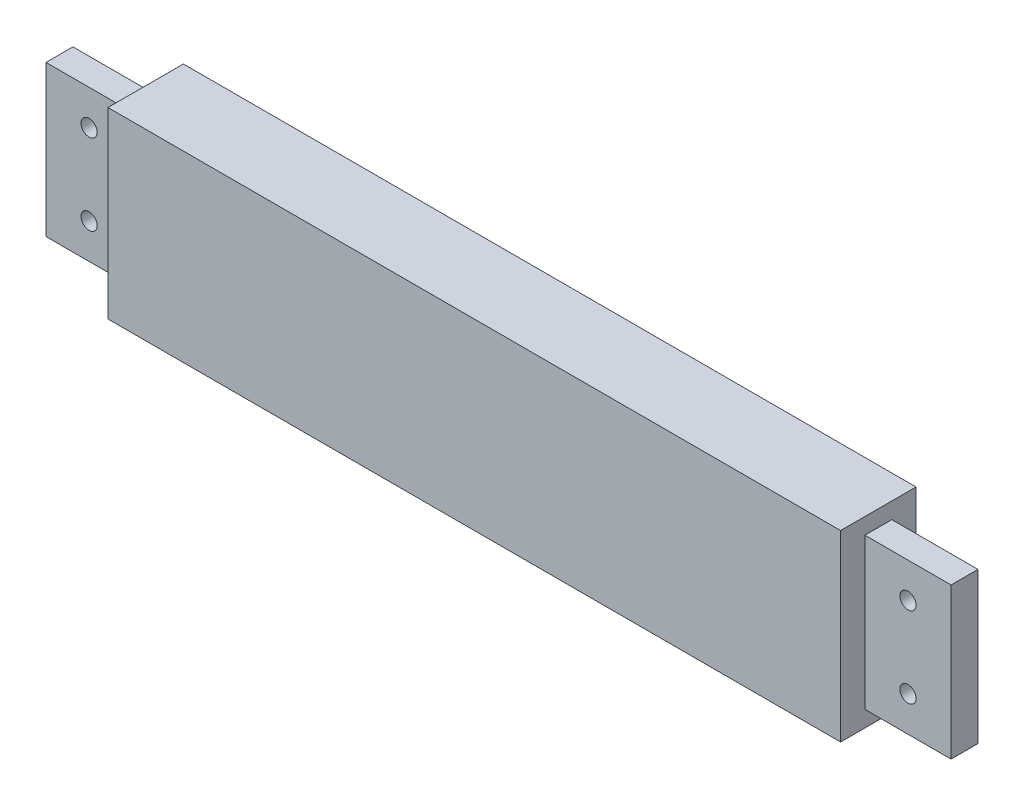
from build123d import *

# Parameters (mm, degrees)
SKETCH1_W           = 431.8
SKETCH1_H           = 107.95
BOSS_EXTRUDE1_DEPTH = 22.225
SKETCH2_W           = 15.875
SKETCH2_H           = 88.9
BOSS_EXTRUDE2_DEPTH = 50.8
SKETCH3_R           = 4.7625
CUT_EXTRUDE1_DEPTH  = 274.773568905
SKETCH4_W           = 3.175
SKETCH4_H           = 9.525
CUT_EXTRUDE2_DEPTH  = 436.727542451


with BuildPart() as part:
    # Sketch1 → Boss-Extrude1 (new, symmetric)
    with BuildSketch(Plane.XY):
        Rectangle(SKETCH1_W, SKETCH1_H)
    extrude(amount=BOSS_EXTRUDE1_DEPTH, both=True)

    # Sketch2 → Boss-Extrude2 (add)
    with BuildSketch(Plane(origin=(215.9, 0, 0), x_dir=(0, 0, -1), z_dir=(1, 0, 0))):
        Rectangle(SKETCH2_W, SKETCH2_H)
    boss_extrude2 = extrude(amount=BOSS_EXTRUDE2_DEPTH)

    # Sketch3 → Cut-Extrude1 (cut, through all)
    with BuildSketch(Plane.XY.offset(7.9375)):
        with Locations((241.3, 23.8125)):
            Circle(SKETCH3_R)
        with Locations((241.3, -23.8125)):
            Circle(SKETCH3_R)
    cut_extrude1 = extrude(amount=-CUT_EXTRUDE1_DEPTH, mode=Mode.SUBTRACT)

    # Sketch4 → Cut-Extrude2 (cut, through all)
    with BuildSketch(Plane(origin=(215.9, 0, 0), x_dir=(0, 0, -1), z_dir=(1, 0, 0))):
        with Locations((20.6375, 23.8125)):
            Rectangle(SKETCH4_W, SKETCH4_H)
    extrude(amount=-CUT_EXTRUDE2_DEPTH, mode=Mode.SUBTRACT)

    # Mirror1: Boss-Extrude2, Cut-Extrude1 across plane
    add(boss_extrude2.mirror(Plane(origin=(0, 0, 0), x_dir=(0, 0, 1), z_dir=(1, 0, 0))))
    add(cut_extrude1.mirror(Plane(origin=(0, 0, 0), x_dir=(0, 0, 1), z_dir=(1, 0, 0))), mode=Mode.SUBTRACT)


solid = part.part
